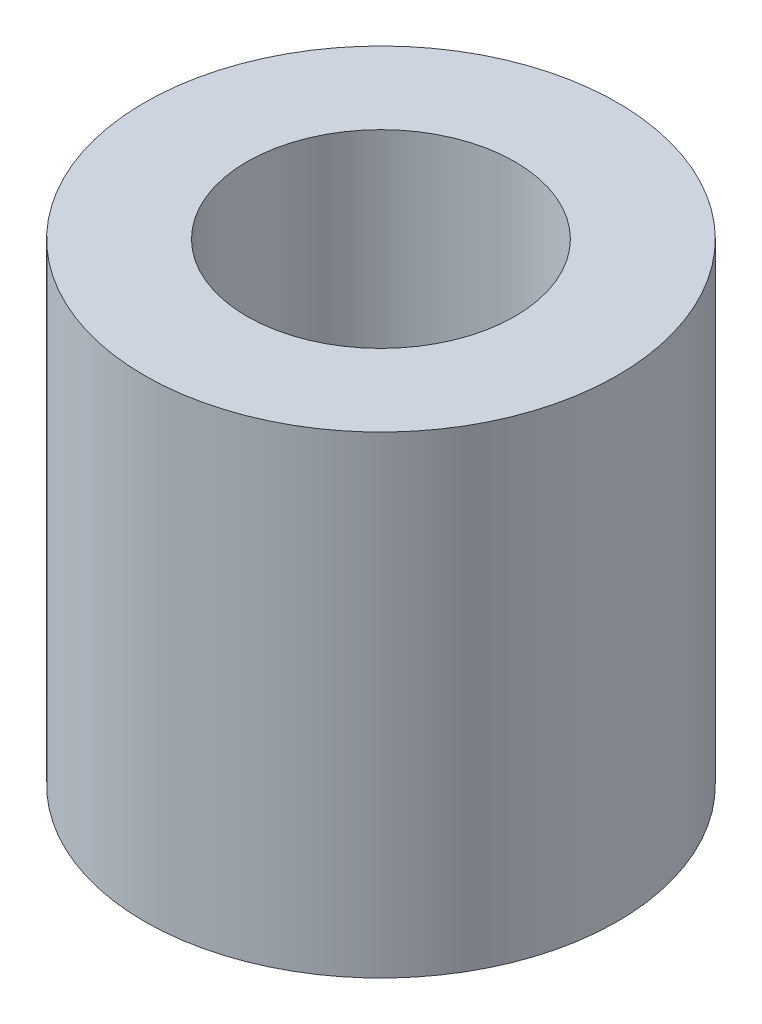
from build123d import *

# Parameters (mm, degrees)
SKETCH1_R            = 3
BOSS_EXTRUDE1_DEPTH  = 6
M3_CLEARANCE_HOLE1_D = 3.4


with BuildPart() as part:
    # Sketch1 → Boss-Extrude1 (new body)
    with BuildSketch(Plane(origin=(0, 0, 0), x_dir=(1, 0, 0), z_dir=(0, 1, 0))):
        with Locations(Location((0, 0, 0), (0, 0, 270))):
            Circle(SKETCH1_R)
    extrude(amount=BOSS_EXTRUDE1_DEPTH)

    # M3 Clearance Hole1 (through all)
    with Locations(Plane(origin=(0, 6, 0), x_dir=(1, 0, 0), z_dir=(0, 1, 0))):
        with Locations((0, 0)):
            Hole(M3_CLEARANCE_HOLE1_D / 2)


solid = part.part
